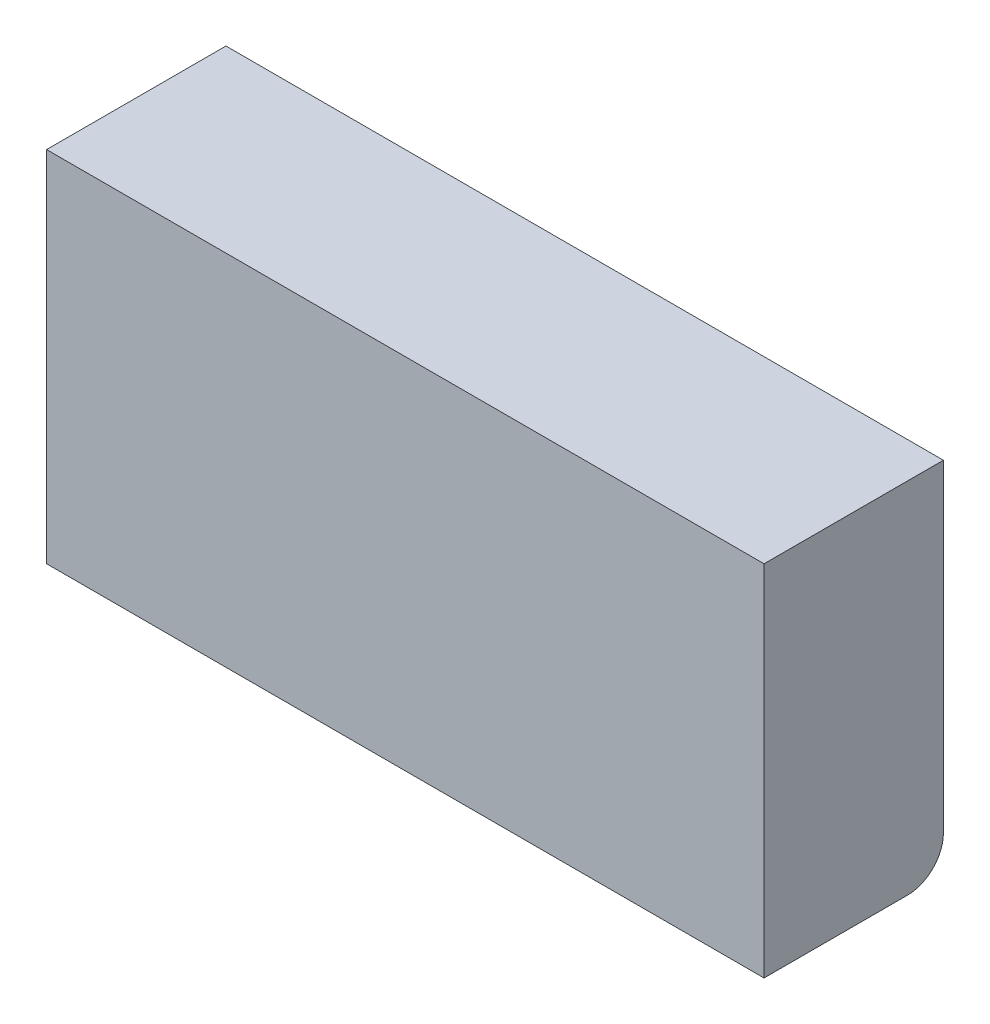
from build123d import *

# Parameters (mm, degrees)
SKETCH1_W           = 40
SKETCH1_H           = 20
BOSS_EXTRUDE1_DEPTH = 10
FILLET1_R           = 2


with BuildPart() as part:
    # Sketch1 → Boss-Extrude1 (new body)
    with BuildSketch(Plane.XY):
        with Locations((20, 10)):
            Rectangle(SKETCH1_W, SKETCH1_H)
    extrude(amount=BOSS_EXTRUDE1_DEPTH)

    # Fillet1
    fillet1_edges = [part.edges().sort_by_distance(p)[0] for p in [
        (20, 0, 0),
    ]]
    fillet(fillet1_edges, radius=FILLET1_R)


solid = part.part
